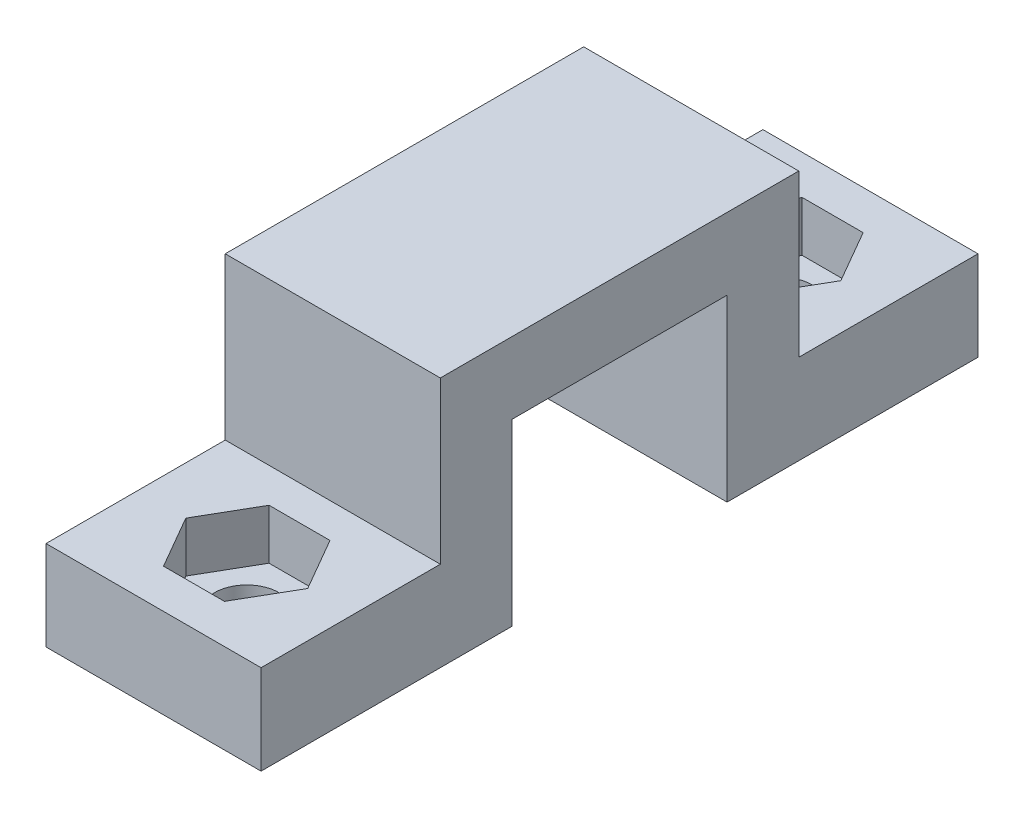
from build123d import *

# Parameters (mm, degrees)
ESBO_O1_W                     = 12
ESBO_O1_H                     = 20
RESSALTO_EXTRUS_O1_DEPTH      = 14
ESBO_O5_W                     = 12
ESBO_O5_H                     = 10
CORTE_EXTRUS_O1_DEPTH         = 12
RESSALTO_EXTRUS_O2_DEPTH      = 10
RESSALTO_EXTRUS_O2_DEPTH_BACK = 30
ESBO_O6_W                     = 12
ESBO_O6_H                     = 5
ESBO_O7_W                     = 12
ESBO_O7_H                     = 5
CORTE_EXTRUS_O2_DEPTH         = 12
ESBO_O8_R                     = 1.8
CORTE_EXTRUS_O3_DEPTH         = 5
ESBO_O8_3_R                   = 1.8
CORTE_EXTRUS_O4_DEPTH         = 5
ESBO_O8_4_R                   = 1.8
CORTE_EXTRUS_O5_DEPTH         = 2.8


with BuildPart() as part:
    # Esboço1 → Ressalto-extrusão1 (new body)
    with BuildSketch(Plane(origin=(0, 0, 0), x_dir=(1, 0, 0), z_dir=(0, 1, 0))):
        Rectangle(ESBO_O1_W, ESBO_O1_H)
    extrude(amount=RESSALTO_EXTRUS_O1_DEPTH)

    # Esboço5 → Corte-extrusão1 (cut)
    with BuildSketch(Plane(origin=(6, 0, 0), x_dir=(0, 0, -1), z_dir=(1, 0, 0))):
        with Locations((0, 5)):
            Rectangle(ESBO_O5_W, ESBO_O5_H)
    extrude(amount=-CORTE_EXTRUS_O1_DEPTH, mode=Mode.SUBTRACT)

    # Esboço6 → Ressalto-extrusão2 (add, two sides: drawn at the far end of the back side and taken through both)
    with BuildSketch(Plane.XY.offset(10).offset(-RESSALTO_EXTRUS_O2_DEPTH_BACK)):
        with Locations((0, 2.5)):
            Rectangle(ESBO_O6_W, ESBO_O6_H)
    extrude(amount=RESSALTO_EXTRUS_O2_DEPTH + RESSALTO_EXTRUS_O2_DEPTH_BACK)

    # Esboço7 → Corte-extrusão2 (cut)
    with BuildSketch(Plane(origin=(6, 0, 0), x_dir=(0, 0, -1), z_dir=(1, 0, 0))):
        with Locations((0, 2.5)):
            Rectangle(ESBO_O7_W, ESBO_O7_H)
    extrude(amount=-CORTE_EXTRUS_O2_DEPTH, mode=Mode.SUBTRACT)

    # Esboço8 → Corte-extrusão3 (cut)
    with BuildSketch(Plane(origin=(0, 5, 0), x_dir=(1, 0, 0), z_dir=(0, 1, 0))):
        with Locations((0.073596401, 14.872527995)):
            Circle(ESBO_O8_R)
    extrude(amount=-CORTE_EXTRUS_O3_DEPTH, mode=Mode.SUBTRACT)

    # Esboço8<3> → Corte-extrusão4 (cut)
    with BuildSketch(Plane(origin=(0, 5, 0), x_dir=(1, 0, 0), z_dir=(0, 1, 0))):
        with Locations((0.073596401, -14.872527995)):
            Circle(ESBO_O8_3_R)
    extrude(amount=-CORTE_EXTRUS_O4_DEPTH, mode=Mode.SUBTRACT)

    # Esboço8<4> → Corte-extrusão5 (cut)
    # profile 1 of 2: a face of its own
    with BuildSketch(Plane(origin=(0, 5, 0), x_dir=(1, 0, 0), z_dir=(0, 1, 0))):
        Polygon((-1.626403599, 11.928041622), (1.773596401, 11.928041622), (3.473596401, 14.872527995), (1.773596401, 17.817014367), (-1.626403599, 17.817014367), (-3.326403599, 14.872527995), align=None)
        with Locations((0.073596401, 14.872527995)):
            Circle(ESBO_O8_4_R, mode=Mode.SUBTRACT)
    # profile 2 of 2: a face of its own
    with BuildSketch(Plane(origin=(0, 5, 0), x_dir=(1, 0, 0), z_dir=(0, 1, 0))):
        Polygon((-3.326403599, -14.872527995), (-1.626403599, -17.817014367), (1.773596401, -17.817014367), (3.473596401, -14.872527995), (1.773596401, -11.928041622), (-1.626403599, -11.928041622), align=None)
        with Locations((0.073596401, -14.872527995)):
            Circle(ESBO_O8_4_R, mode=Mode.SUBTRACT)
    extrude(amount=-CORTE_EXTRUS_O5_DEPTH, mode=Mode.SUBTRACT)


solid = part.part
